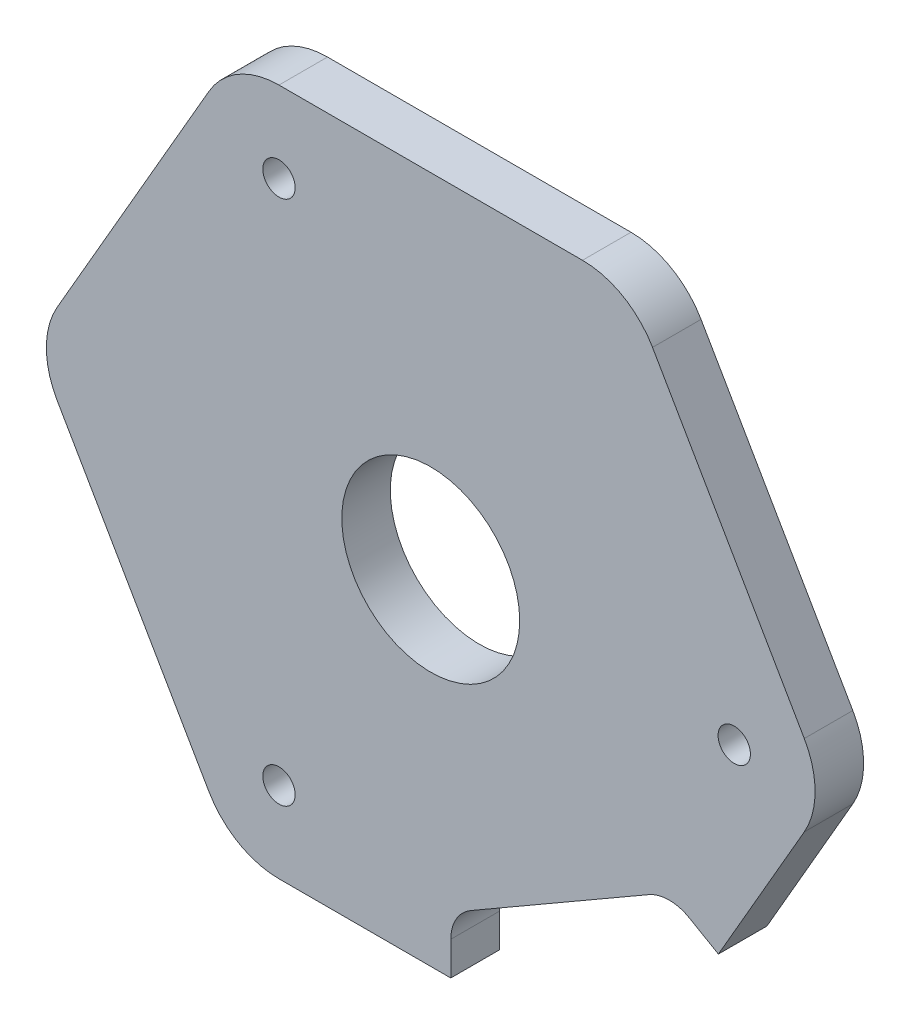
from build123d import *

# Parameters (mm, degrees)
SKETCH1_R           = 1.999999997
SKETCH1_R_2         = 10.999999998
SKETCH1_R_3         = 1.999999998
BOSS_EXTRUDE1_DEPTH = 6


with BuildPart() as part:
    # Sketch1 → Boss-Extrude1 (new body)
    with BuildSketch(Plane.XY):
        with BuildLine():
            Line((-57.700744027, 162.345498824), (-95.228511524, 162.345498823))
            ThreePointArc((-95.228511524, 162.345498823), (-100.228511524, 161.005752861), (-103.888765562, 157.345498823))
            Line((-103.888765562, 157.345498823), (-122.65264931, 124.845498823))
            ThreePointArc((-122.65264931, 124.845498823), (-123.992395272, 119.845498822), (-122.65264931, 114.845498822))
            Line((-122.65264931, 114.845498822), (-103.88876556, 82.345498823))
            ThreePointArc((-103.88876556, 82.345498823), (-100.228511522, 78.685244785), (-95.228511522, 77.345498823))
            Line((-95.228511522, 77.345498823), (-73.987721784, 77.345498823))
            Line((-73.987721784, 77.345498823), (-73.987721784, 81.491705925))
            ThreePointArc((-73.987721784, 81.491705925), (-73.317848803, 83.991705925), (-71.487721784, 85.821832944))
            Line((-71.487721784, 85.821832944), (-49.487721784, 98.523538865))
            ThreePointArc((-49.487721784, 98.523538865), (-46.987721783, 99.193411846), (-44.487721784, 98.523538865))
            Line((-44.487721784, 98.523538865), (-40.897001108, 96.450435316))
            Line((-40.897001108, 96.450435316), (-30.276606238, 114.845498825))
            ThreePointArc((-30.276606238, 114.845498825), (-28.936860276, 119.845498825), (-30.276606239, 124.845498826))
            Line((-30.276606239, 124.845498826), (-49.040489989, 157.345498825))
            ThreePointArc((-49.040489989, 157.345498825), (-52.700744027, 161.005752862), (-57.700744027, 162.345498824))
        make_face()
        with Locations((-38.936860277, 119.845498824)):
            Circle(SKETCH1_R, mode=Mode.SUBTRACT)
        with Locations((-95.228511522, 87.345498823)):
            Circle(SKETCH1_R, mode=Mode.SUBTRACT)
        with Locations((-76.464627774, 119.845498824)):
            Circle(SKETCH1_R_2, mode=Mode.SUBTRACT)
        with Locations((-95.228511523, 152.345498823)):
            Circle(SKETCH1_R_3, mode=Mode.SUBTRACT)
    extrude(amount=BOSS_EXTRUDE1_DEPTH)


solid = part.part
